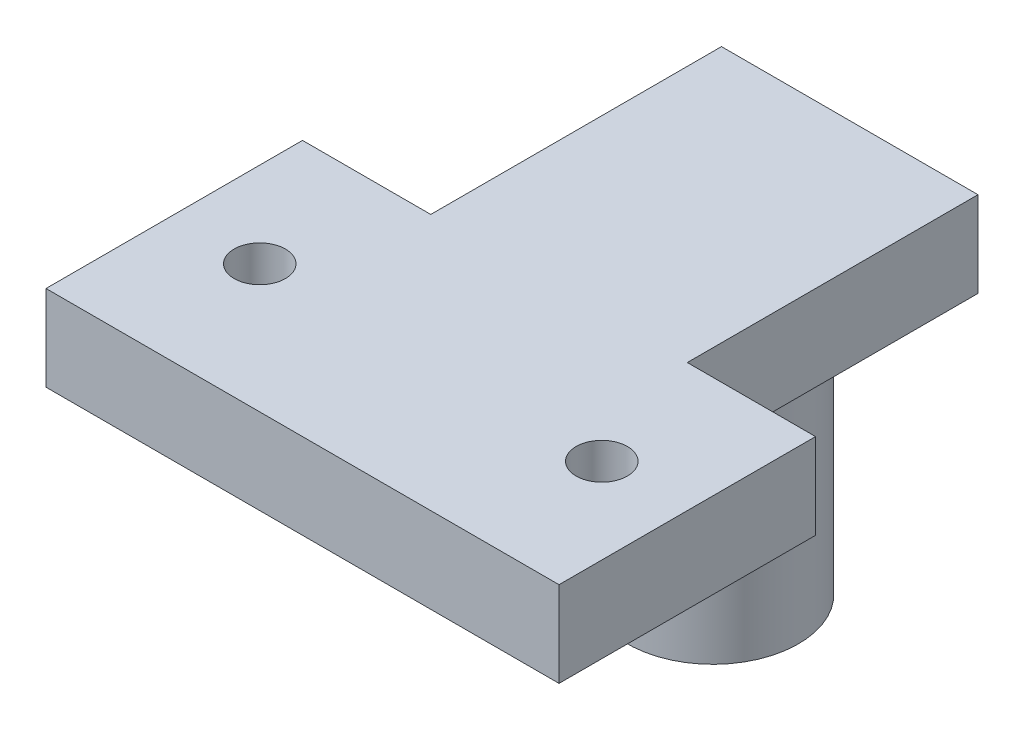
from build123d import *

# Parameters (mm, degrees)
SKETCH1_W           = 30
SKETCH1_H           = 15
SKETCH1_R           = 1.5
SKETCH1_W_2         = 15
SKETCH1_H_2         = 17
SKETCH1_R_2         = 5
BOSS_EXTRUDE1_DEPTH = 5
SKETCH3_R           = 5
BOSS_EXTRUDE2_DEPTH = 15


with BuildPart() as part:
    # Sketch1 → Boss-Extrude1 (new body)
    # profile 1 of 3: a face of its own
    with BuildSketch(Plane(origin=(0, 0, 0), x_dir=(1, 0, 0), z_dir=(0, 1, 0))):
        with Locations((-15, -7.5)):
            Rectangle(SKETCH1_W, SKETCH1_H)
        with Locations(Location((-5, -7.5, 0), (0, 0, 270))):
            Circle(SKETCH1_R, mode=Mode.SUBTRACT)
        with Locations(Location((-25, -7.5, 0), (0, 0, 270))):
            Circle(SKETCH1_R, mode=Mode.SUBTRACT)
    # profile 2 of 3: a face of its own
    with BuildSketch(Plane(origin=(0, 0, 0), x_dir=(1, 0, 0), z_dir=(0, 1, 0))):
        with Locations((-15, 8.5)):
            Rectangle(SKETCH1_W_2, SKETCH1_H_2)
        with Locations((-15, 9)):
            Circle(SKETCH1_R_2, mode=Mode.SUBTRACT)
    # profile 3 of 3: a face of its own
    with BuildSketch(Plane(origin=(0, 0, 0), x_dir=(1, 0, 0), z_dir=(0, 1, 0))):
        with Locations((-15, 9)):
            Circle(SKETCH1_R_2)
    extrude(amount=BOSS_EXTRUDE1_DEPTH)

    # Sketch3 → Boss-Extrude2 (add)
    with BuildSketch(Plane.XZ):
        with Locations(Location((-15, -9, 0), (0, 0, 270))):
            Circle(SKETCH3_R)
    extrude(amount=BOSS_EXTRUDE2_DEPTH)


solid = part.part
